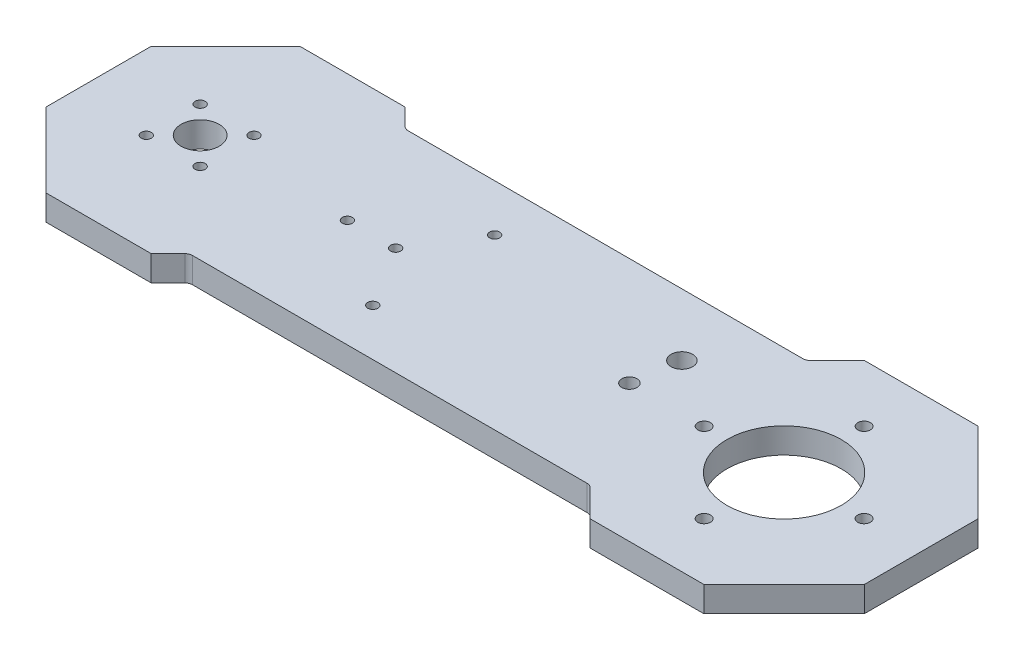
from build123d import *

# Parameters (mm, degrees)
EXTRUDE_1_DEPTH      = 10
SKETCH_2_R           = 2.5
CUT_EXTRUDE_1_DEPTH  = 10
CHAMFER_1_SIZE       = 2
SKETCH_4_R           = 22.5
CUT_EXTRUDE_3_DEPTH  = 36
SKETCH_9_R           = 3
CUT_EXTRUDE_8_DEPTH  = 13
SKETCH_10_R          = 4.25
CUT_EXTRUDE_9_DEPTH  = 13
CHAMFER_6_SIZE       = 1
SKETCH_6_R           = 7.5
CUT_EXTRUDE_10_DEPTH = 10
SKETCH_11_R          = 2
CUT_EXTRUDE_11_DEPTH = 15
SKETCH_12_R          = 2
CUT_EXTRUDE_12_DEPTH = 15
SKETCH_13_R          = 2
CUT_EXTRUDE_13_DEPTH = 10
SKETCH_14_R          = 22.5
SKETCH_14_R_2        = 4.25
SKETCH_14_R_3        = 2.5
SKETCH_14_R_4        = 3
SKETCH_14_R_5        = 2
SKETCH_14_R_6        = 7.5
EXTRUDE_2_DEPTH      = 10
CHAMFER_7_SIZE       = 2.9
CHAMFER_8_SIZE       = 1.9
FILLET_2_R           = 3


with BuildPart() as part:
    # Эскиз1 → Бобышка-Вытянуть1 (new body)
    with BuildSketch(Plane(origin=(0, 0, 0), x_dir=(1, 0, 0), z_dir=(0, 1, 0))):
        with BuildLine():
            Line((-172.682149641, 42.5), (-12.334194433, 42.5))
            ThreePointArc((-12.334194433, 42.5), (74.978715977, 0), (-12.334194433, -42.5))
            Line((-12.334194433, -42.5), (-172.682149641, -42.5))
            ThreePointArc((-172.682149641, -42.5), (-249.021284023, 0), (-172.682149641, 42.5))
        make_face()
    extrude(amount=EXTRUDE_1_DEPTH)

    # Эскиз2 → Вырез-Вытянуть1 (cut)
    with BuildSketch(Plane(origin=(0, 10, 0), x_dir=(1, 0, 0), z_dir=(0, 1, 0))):
        with Locations(Location((20.978715977, 31.5, 0), (0, 0, 270))):
            Circle(SKETCH_2_R)
        with Locations(Location((-10.521284023, 0, 0), (0, 0, 270))):
            Circle(SKETCH_2_R)
        with Locations(Location((20.978715977, -31.5, 0), (0, 0, 270))):
            Circle(SKETCH_2_R)
        with Locations(Location((52.478715977, 0, 0), (0, 0, 270))):
            Circle(SKETCH_2_R)
    extrude(amount=-CUT_EXTRUDE_1_DEPTH, mode=Mode.SUBTRACT)

    # Фаска1
    chamfer_1_edges = [part.edges().sort_by_distance(p)[0] for p in [
        (20.978715977, 0, -34),
        (-10.521284023, 0, -2.5),
        (20.978715977, 0, 29),
        (52.478715977, 0, -2.5),
    ]]
    chamfer(chamfer_1_edges, length=CHAMFER_1_SIZE)

    # Эскиз4 → Вырез-Вытянуть3 (cut)
    with BuildSketch(Plane.XZ):
        with Locations(Location((20.978715977, 0, 0), (0, 0, 270))):
            Circle(SKETCH_4_R)
    extrude(amount=-CUT_EXTRUDE_3_DEPTH, mode=Mode.SUBTRACT)

    # Эскиз9 → Вырез-Вытянуть8 (cut)
    with BuildSketch(Plane(origin=(0, 10, 0), x_dir=(1, 0, 0), z_dir=(0, 1, 0))):
        with Locations(Location((-39.951971169, 0, 0), (0, 0, 270))):
            Circle(SKETCH_9_R)
    extrude(amount=-CUT_EXTRUDE_8_DEPTH, mode=Mode.SUBTRACT)

    # Эскиз10 → Вырез-Вытянуть9 (cut)
    with BuildSketch(Plane(origin=(0, 10, 0), x_dir=(1, 0, 0), z_dir=(0, 1, 0))):
        with Locations(Location((-37.333322344, 18.054624514, 0), (0, 0, 270))):
            Circle(SKETCH_10_R)
    extrude(amount=-CUT_EXTRUDE_9_DEPTH, mode=Mode.SUBTRACT)

    # Фаска6
    chamfer_6_edges = [part.edges().sort_by_distance(p)[0] for p in [
        (-37.333322344, 0, -22.304624514),
    ]]
    chamfer(chamfer_6_edges, length=CHAMFER_6_SIZE)

    # Эскиз6 → Вырез-Вытянуть10 (cut)
    with BuildSketch(Plane.XZ):
        with Locations(Location((-209.021284023, 0, 0), (0, 0, 270))):
            Circle(SKETCH_6_R)
    extrude(amount=-CUT_EXTRUDE_10_DEPTH, mode=Mode.SUBTRACT)

    # Эскиз11 → Вырез-Вытянуть11 (cut)
    with BuildSketch(Plane.XZ):
        with Locations(Location((-117.021284023, 24, 0), (0, 0, 270))):
            Circle(SKETCH_11_R)
        with Locations(Location((-117.021284023, -24, 0), (0, 0, 270))):
            Circle(SKETCH_11_R)
    extrude(amount=-CUT_EXTRUDE_11_DEPTH, mode=Mode.SUBTRACT)

    # Эскиз12 → Вырез-Вытянуть12 (cut)
    with BuildSketch(Plane.XZ):
        with Locations(Location((-151.021284023, 0, 0), (0, 0, 270))):
            Circle(SKETCH_12_R)
        with Locations(Location((-132.021284023, 0, 0), (0, 0, 270))):
            Circle(SKETCH_12_R)
    extrude(amount=-CUT_EXTRUDE_12_DEPTH, mode=Mode.SUBTRACT)

    # Эскиз13 → Вырез-Вытянуть13 (cut)
    with BuildSketch(Plane(origin=(0, 0, 0), x_dir=(-1, 0, 0), z_dir=(0, -1, 0))):
        with Locations(Location((219.627885741, -10.606601718, 0), (0, 0, 90))):
            Circle(SKETCH_13_R)
        with Locations(Location((198.414682305, -10.606601718, 0), (0, 0, 90))):
            Circle(SKETCH_13_R)
        with Locations(Location((219.627885741, 10.606601718, 0), (0, 0, 90))):
            Circle(SKETCH_13_R)
        with Locations(Location((198.414682305, 10.606601718, 0), (0, 0, 90))):
            Circle(SKETCH_13_R)
    extrude(amount=-CUT_EXTRUDE_13_DEPTH, mode=Mode.SUBTRACT)

    # Эскиз14 → Бобышка-Вытянуть2 (add)
    with BuildSketch(Plane(origin=(0, 0, 0), x_dir=(-1, 0, 0), z_dir=(0, -1, 0))):
        Polygon((170.810605904, -42.5), (12.888816391, -42.5), (1.388816391, -54), (-43.346248345, -54), (-74.978715977, -22.367532368), (-74.978715977, 22.367532368), (-43.346248345, 54), (1.388816391, 54), (12.888816391, 42.5), (170.810605904, 42.5), (178.310605904, 50), (219.731962142, 50), (249.021284023, 20.710678119), (249.021284023, -20.710678119), (219.731962142, -50), (178.310605904, -50), align=None)
        with Locations(Location((-20.978715977, 0, 0), (0, 0, 90))):
            Circle(SKETCH_14_R, mode=Mode.SUBTRACT)
        with Locations(Location((37.333322344, 18.054624514, 0), (0, 0, 270))):
            Circle(SKETCH_14_R_2, mode=Mode.SUBTRACT)
        with Locations(Location((10.521284023, 0, 0), (0, 0, 270))):
            Circle(SKETCH_14_R_3, mode=Mode.SUBTRACT)
        with Locations(Location((-52.478715977, 0, 0), (0, 0, 270))):
            Circle(SKETCH_14_R_3, mode=Mode.SUBTRACT)
        with Locations(Location((-20.978715977, 31.5, 0), (0, 0, 270))):
            Circle(SKETCH_14_R_3, mode=Mode.SUBTRACT)
        with Locations(Location((-20.978715977, -31.5, 0), (0, 0, 270))):
            Circle(SKETCH_14_R_3, mode=Mode.SUBTRACT)
        with Locations(Location((39.951971169, 0, 0), (0, 0, 270))):
            Circle(SKETCH_14_R_4, mode=Mode.SUBTRACT)
        with Locations(Location((117.021284023, 24, 0), (0, 0, 90))):
            Circle(SKETCH_14_R_5, mode=Mode.SUBTRACT)
        with Locations(Location((132.021284023, 0, 0), (0, 0, 90))):
            Circle(SKETCH_14_R_5, mode=Mode.SUBTRACT)
        with Locations(Location((117.021284023, -24, 0), (0, 0, 90))):
            Circle(SKETCH_14_R_5, mode=Mode.SUBTRACT)
        with Locations(Location((151.021284023, 0, 0), (0, 0, 90))):
            Circle(SKETCH_14_R_5, mode=Mode.SUBTRACT)
        with Locations(Location((198.414682305, -10.606601718, 0), (0, 0, 90))):
            Circle(SKETCH_14_R_5, mode=Mode.SUBTRACT)
        with Locations(Location((198.414682305, 10.606601718, 0), (0, 0, 90))):
            Circle(SKETCH_14_R_5, mode=Mode.SUBTRACT)
        with Locations(Location((209.021284023, 0, 0), (0, 0, 90))):
            Circle(SKETCH_14_R_6, mode=Mode.SUBTRACT)
        with Locations(Location((219.627885741, 10.606601718, 0), (0, 0, 90))):
            Circle(SKETCH_14_R_5, mode=Mode.SUBTRACT)
        with Locations(Location((219.627885741, -10.606601718, 0), (0, 0, 90))):
            Circle(SKETCH_14_R_5, mode=Mode.SUBTRACT)
    extrude(amount=-EXTRUDE_2_DEPTH)

    # Фаска7
    chamfer_7_edges = [part.edges().sort_by_distance(p)[0] for p in [
        (-10.521284023, 0, -2.5),
        (52.478715977, 0, -2.5),
        (20.978715977, 0, -34),
        (20.978715977, 0, 29),
    ]]
    chamfer(chamfer_7_edges, length=CHAMFER_7_SIZE)

    # Фаска8
    chamfer_8_edges = [part.edges().sort_by_distance(p)[0] for p in [
        (-198.414682305, 0, 12.606601718),
        (-219.627885741, 0, -8.606601718),
        (-198.414682305, 0, -8.606601718),
        (-219.627885741, 0, 12.606601718),
    ]]
    chamfer(chamfer_8_edges, length=CHAMFER_8_SIZE)

    # Скругление2
    fillet_2_edges = [part.edges().sort_by_distance(p)[0] for p in [
        (-170.810605904, 5, 42.5),
        (-12.888816391, 5, 42.5),
        (-12.888816391, 5, -42.5),
        (-170.810605904, 5, -42.5),
    ]]
    fillet(fillet_2_edges, radius=FILLET_2_R)


solid = part.part
